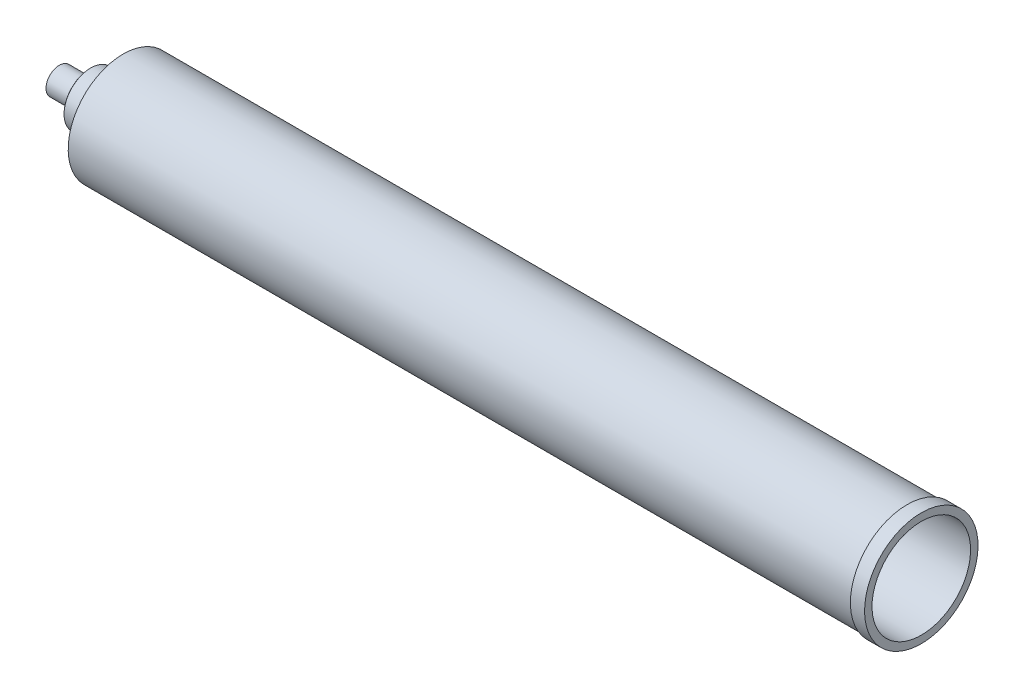
from build123d import *

# Parameters (mm, degrees)
SKETCH19_R         = 4
CUT_EXTRUDE3_DEPTH = 25.4


with BuildPart() as part:
    # Sketch1 → Revolve1 (revolve)
    with BuildSketch(Plane.XY):
        with BuildLine():
            Line((0, 0), (0, 11.938))
            Line((0, 11.938), (24.765, 11.938))
            ThreePointArc((24.765, 11.938), (26.561051224, 12.681948776), (27.305, 14.478))
            Line((27.305, 14.478), (27.305, 22.933028409))
            Line((27.305, 22.933028409), (28.104406531, 23.876))
            Line((28.104406531, 23.876), (57.15, 23.876))
            Line((57.15, 23.876), (57.15, 49.2125))
            Line((57.15, 49.2125), (759.206, 49.2125))
            Line((759.206, 49.2125), (759.206, 50.8))
            Line((759.206, 50.8), (771.906, 50.8))
            Line((771.906, 50.8), (771.906, 49.2125))
            Line((771.906, 49.2125), (771.906, 44.1325))
            Line((771.906, 44.1325), (62.23, 44.1325))
            Line((62.23, 44.1325), (62.23, 0))
            Line((62.23, 0), (0, 0))
        make_face()
    revolve(axis=Axis((62.23, 0, 0), (-1, 0, 0)))

    # Sketch16 → Cut-Revolve1 (revolve, cut)
    with BuildSketch(Plane(origin=(0, 0, 0), x_dir=(1, 0, 0), z_dir=(0, 1, 0))):
        Polygon((0, 0), (0, 8.35025), (1.905, 6.556375), (1.905, 0), align=None)
    revolve(axis=Axis((1.905, 0, 0), (-1, 0, 0)), mode=Mode.SUBTRACT)

    # Sketch19 → Cut-Extrude3 (cut)
    with BuildSketch(Plane.ZY.offset(-1.905)):
        Circle(SKETCH19_R)
    extrude(amount=-CUT_EXTRUDE3_DEPTH, mode=Mode.SUBTRACT)

    # Sketch32 → Cut-Revolve6 (revolve, cut)
    with BuildSketch(Plane(origin=(0, 0, 0), x_dir=(1, 0, 0), z_dir=(0, 1, 0)), mode=Mode.PRIVATE) as cut_revolve6_sk:
        Polygon((27.305, 0), (28.575, 0), (27.305, 6.351059428), align=None)
    revolve(cut_revolve6_sk.sketch.rotate(Axis((27.305, 0, 0), (1, 0, 0)), 180), axis=Axis((27.305, 0, 0), (1, 0, 0)), mode=Mode.SUBTRACT)


solid = part.part
